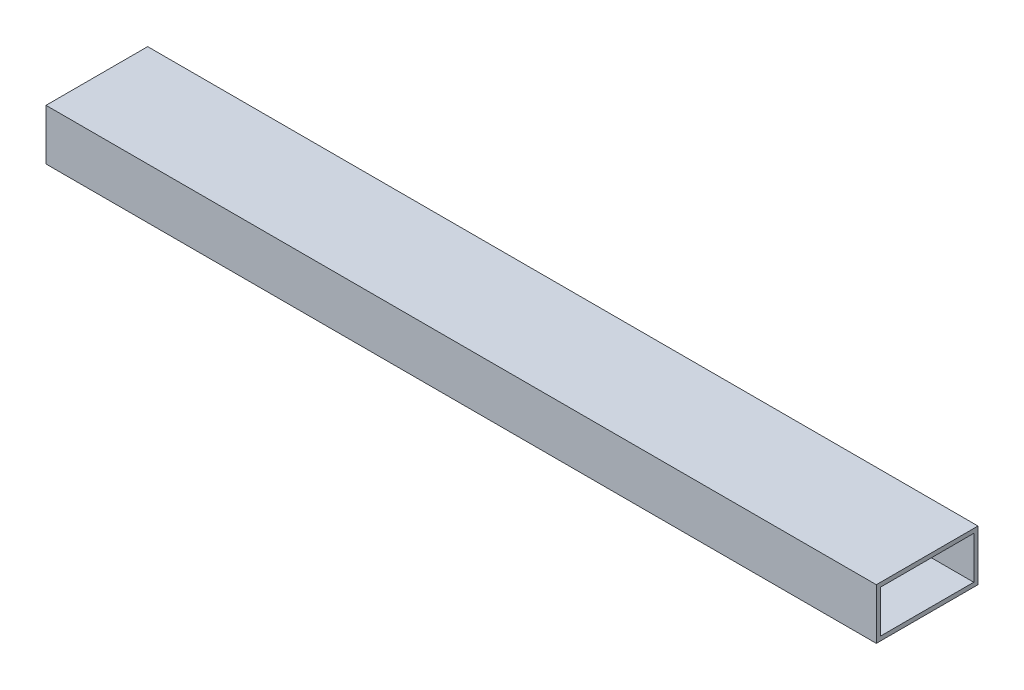
from build123d import *

# Parameters (mm, degrees)
SKETCH1_W                   = 76.2
SKETCH1_H                   = 38.1
SKETCH1_W_2                 = 69.85
SKETCH1_H_2                 = 31.75
BOSS_EXTRUDE1_DEPTH         = 311.15
F_1_4_20_TAPPED_HOLE1_D     = 5.1054
F_1_4_20_TAPPED_HOLE1_DEPTH = 3.175


with BuildPart() as part:
    # Sketch1 → Boss-Extrude1 (new, symmetric)
    with BuildSketch(Plane(origin=(0, 0, 0), x_dir=(0, 0, -1), z_dir=(1, 0, 0))):
        with Locations((38.1, 19.05)):
            Rectangle(SKETCH1_W, SKETCH1_H)
        with Locations((38.1, 19.05)):
            Rectangle(SKETCH1_W_2, SKETCH1_H_2, mode=Mode.SUBTRACT)
    extrude(amount=BOSS_EXTRUDE1_DEPTH, both=True)

    # 1/4-20 Tapped Hole1
    with Locations(Plane(origin=(0, 0, -76.2), x_dir=(-1, 0, 0), z_dir=(0, 0, -1))):
        with Locations((260.35, 19.05), (-260.35, 19.05)):
            Hole(F_1_4_20_TAPPED_HOLE1_D / 2, depth=F_1_4_20_TAPPED_HOLE1_DEPTH)


solid = part.part
